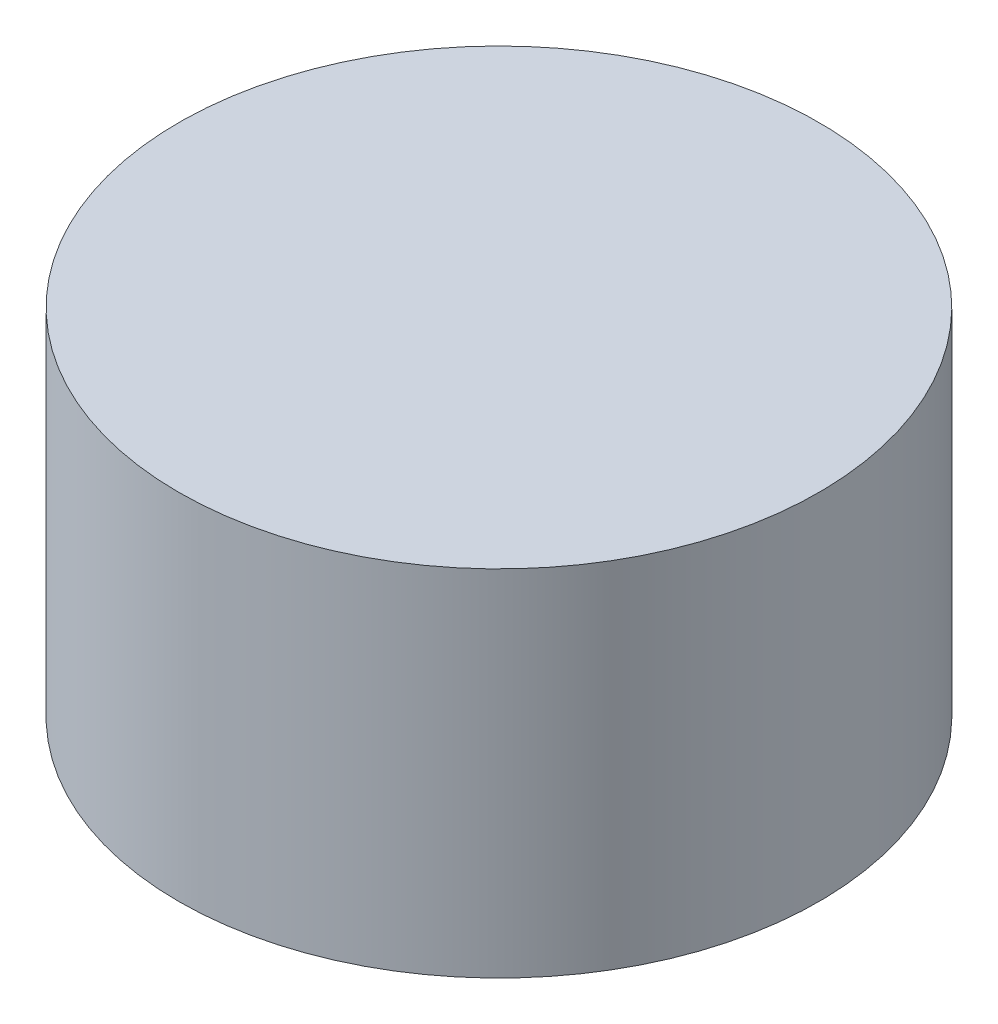
from build123d import *

# Parameters (mm, degrees)
SKETCH1_R           = 10.925
BOSS_EXTRUDE1_DEPTH = 12.09


with BuildPart() as part:
    # Sketch1 → Boss-Extrude1 (new body)
    with BuildSketch(Plane(origin=(0, 0, 0), x_dir=(1, 0, 0), z_dir=(0, 1, 0))):
        with Locations(Location((0, 0, 0), (0, 0, 270))):
            Circle(SKETCH1_R)
    extrude(amount=BOSS_EXTRUDE1_DEPTH)


solid = part.part
